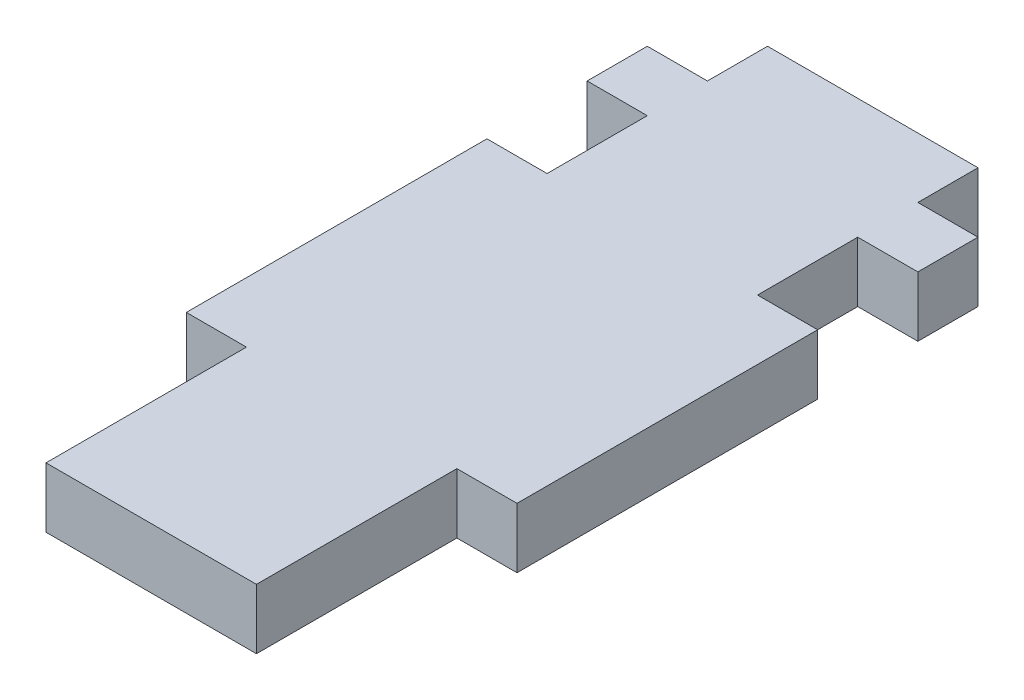
from build123d import *

# Parameters (mm, degrees)
EXTRUDE_1_DEPTH = 3


with BuildPart() as part:
    # 草图1 → 凸台-拉伸1 (new body)
    with BuildSketch(Plane(origin=(0, 0, 0), x_dir=(1, 0, 0), z_dir=(0, 1, 0))):
        Polygon((3, 0), (3, -5), (0, -5), (0, -20), (3, -20), (3, -30), (13.5, -30), (13.5, -20), (16.5, -20), (16.5, -5), (13.5, -5), (13.5, 0), (16.5, 0), (16.5, 3), (13.5, 3), (13.5, 6), (3, 6), (3, 3), (0, 3), (0, 0), align=None)
    extrude(amount=EXTRUDE_1_DEPTH)


solid = part.part
